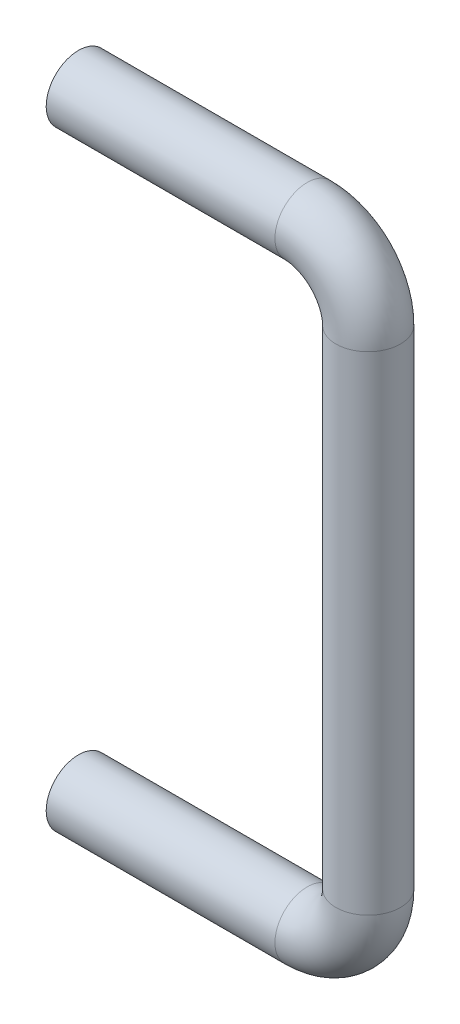
from build123d import *

# Parameters (mm, degrees)
TUBE_PROFILE_R   = 3.175
TUBE_PROFILE_R_2 = 2.175


with BuildPart() as part:
    # Tube: sweep along a curve in space
    with BuildLine() as tube_path:
        Line((131.5, 40, 50), (154, 40, 50))
        ThreePointArc((160, 46, 50), (158.242640687, 41.757359313, 50), (154, 40, 50))
        Line((160, 46, 50), (160, 94, 50))
        ThreePointArc((154, 100, 50), (158.242640687, 98.242640687, 50), (160, 94, 50))
        Line((154, 100, 50), (131.5, 100, 50))
    # Tube profile (on start of the path) → Tube (sweep)
    with BuildSketch(Plane(origin=(131.5, 40, 50), x_dir=(0, 0, 1), z_dir=(1, 0, 0))):
        Circle(TUBE_PROFILE_R)
        Circle(TUBE_PROFILE_R_2, mode=Mode.SUBTRACT)
    sweep(path=tube_path.line)


solid = part.part
